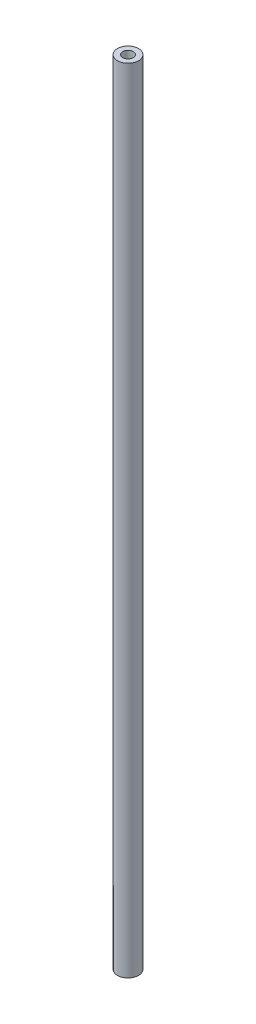
from build123d import *

# Parameters (mm, degrees)
SKETCH2_R           = 0.1016
SKETCH2_R_2         = 0.0508
BOSS_EXTRUDE1_DEPTH = 7.62


with BuildPart() as part:
    # Sketch2 → Boss-Extrude1 (new body)
    with BuildSketch(Plane(origin=(0, 0, 0), x_dir=(1, 0, 0), z_dir=(0, 1, 0))):
        with Locations(Location((0, 0, 0), (0, 0, 270))):
            Circle(SKETCH2_R)
        with Locations(Location((0, 0, 0), (0, 0, 270))):
            Circle(SKETCH2_R_2, mode=Mode.SUBTRACT)
    extrude(amount=BOSS_EXTRUDE1_DEPTH)


solid = part.part
